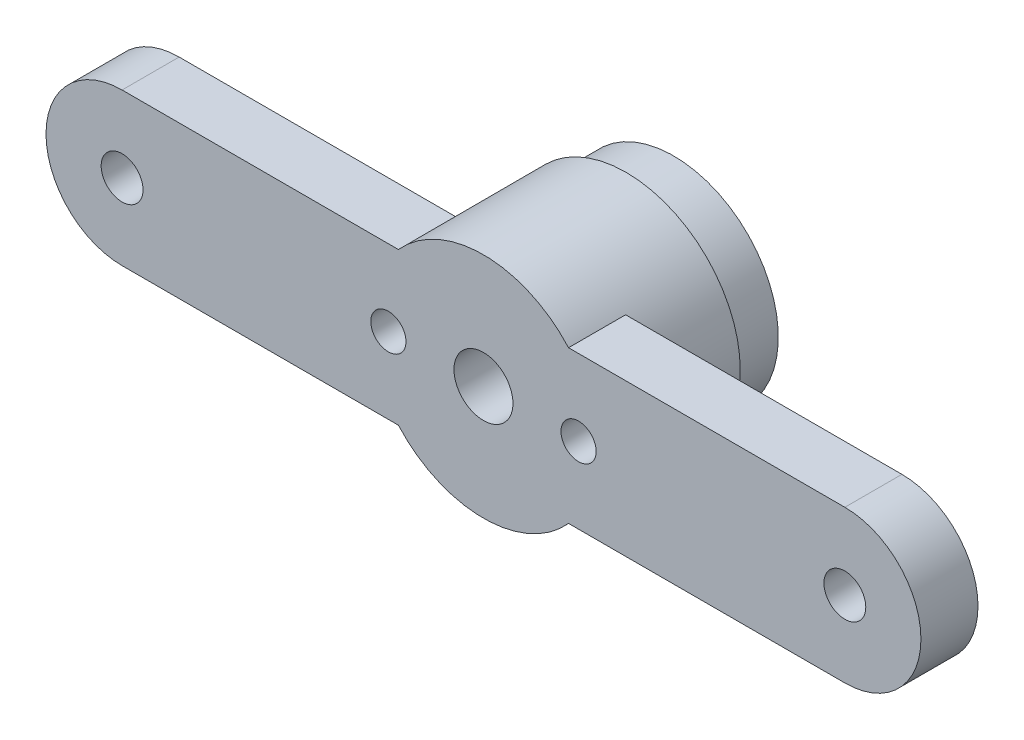
from build123d import *

# Parameters (mm, degrees)
SKETCH_1_R               = 1.55
SKETCH_1_R_2             = 1.1
EXTRUDE_1_DEPTH          = 3
EXTRUDE_START            = 4.5
SKETCH_2_R               = 6
EXTRUDE_2_DEPTH          = 4.5
SKETCH_3_R               = 5.5
EXTRUDE_3_DEPTH          = 2.5
SKETCH_5_R               = 0.4
CUT_EXTRUDE_1_DEPTH      = 5
PATTERN_CIRCULAR_2_COUNT = 25
SKETCH_4_R               = 2.6
CUT_EXTRUDE_2_DEPTH      = 5
CUT_EXTRUDE_START        = -30
SKETCH_6_R               = 1.55
CUT_EXTRUDE_3_DEPTH      = 30
SKETCH_7_R               = 0.925
CUT_EXTRUDE_4_DEPTH      = 6
SKETCH_8_W               = 1.6
SKETCH_8_H               = 4.2
CUT_EXTRUDE_5_DEPTH      = 3.2
SKETCH_9_W               = 1.6
SKETCH_9_H               = 4.2
CUT_EXTRUDE_6_DEPTH      = 3.2


with BuildPart() as part:
    # 草图1 → 凸台-拉伸1 (new body)
    with BuildSketch(Plane.XY):
        with BuildLine():
            Line((4.472135955, 4), (19, 4))
            ThreePointArc((19, 4), (23, 0), (19, -4))
            Line((19, -4), (4.472135955, -4))
            ThreePointArc((4.472135955, -4), (0, -6), (-4.472135955, -4))
            Line((-4.472135955, -4), (-19, -4))
            ThreePointArc((-19, -4), (-23, 0), (-19, 4))
            Line((-19, 4), (-4.472135955, 4))
            ThreePointArc((-4.472135955, 4), (0, 6), (4.472135955, 4))
        make_face()
        Circle(SKETCH_1_R, mode=Mode.SUBTRACT)
        with Locations((19, 0)):
            Circle(SKETCH_1_R_2, mode=Mode.SUBTRACT)
        with Locations((-19, 0)):
            Circle(SKETCH_1_R_2, mode=Mode.SUBTRACT)
    extrude(amount=EXTRUDE_1_DEPTH)

    # 草图2 → 凸台-拉伸2 (add)
    with BuildSketch(Plane(origin=(0, 0, 0), x_dir=(-1, 0, 0), z_dir=(0, 0, -1)).offset(EXTRUDE_START)):
        Circle(SKETCH_2_R)
    extrude(amount=-EXTRUDE_2_DEPTH)

    # 草图3 → 凸台-拉伸3 (add)
    with BuildSketch(Plane(origin=(0, 0, -4.5), x_dir=(-1, 0, 0), z_dir=(0, 0, -1))):
        Circle(SKETCH_3_R)
    extrude(amount=EXTRUDE_3_DEPTH)

    # 草图5 → 切除-拉伸1 (cut)
    with BuildSketch(Plane(origin=(0, 0, -7), x_dir=(-1, 0, 0), z_dir=(0, 0, -1))):
        with Locations((0, 2.6)):
            Circle(SKETCH_5_R)
    cut_extrude_1 = extrude(amount=-CUT_EXTRUDE_1_DEPTH, mode=Mode.SUBTRACT)

    # 阵列(圆周)2: 切除-拉伸1 ×25 about axis
    pattern_circular_2_axis = Axis((0, 0, 0), (0, 0, 1))
    for i in range(1, PATTERN_CIRCULAR_2_COUNT):
        add(cut_extrude_1.rotate(pattern_circular_2_axis, i * 360 / PATTERN_CIRCULAR_2_COUNT), mode=Mode.SUBTRACT)

    # 草图4 → 切除-拉伸2 (cut)
    with BuildSketch(Plane(origin=(0, 0, -7), x_dir=(-1, 0, 0), z_dir=(0, 0, -1))):
        Circle(SKETCH_4_R)
    extrude(amount=-CUT_EXTRUDE_2_DEPTH, mode=Mode.SUBTRACT)

    # 草图6 → 切除-拉伸3 (cut)
    with BuildSketch(Plane.XY.offset(3).offset(CUT_EXTRUDE_START)):
        with Locations(Location((0, 0, 0), (0, 0, 180))):
            Circle(SKETCH_6_R)
    extrude(amount=CUT_EXTRUDE_3_DEPTH, mode=Mode.SUBTRACT)

    # 草图7 → 切除-拉伸4 (cut)
    with BuildSketch(Plane.XY.offset(3)):
        with Locations((5, 0)):
            Circle(SKETCH_7_R)
        with Locations((-5, 0)):
            Circle(SKETCH_7_R)
    extrude(amount=-CUT_EXTRUDE_4_DEPTH, mode=Mode.SUBTRACT)

    # 草图8 → 切除-拉伸5 (cut)
    with BuildSketch(Plane(origin=(6, 0, 0), x_dir=(0, 0, -1), z_dir=(1, 0, 0))):
        with Locations((0.8, 0)):
            Rectangle(SKETCH_8_W, SKETCH_8_H)
    extrude(amount=-CUT_EXTRUDE_5_DEPTH, mode=Mode.SUBTRACT)

    # 草图9 → 切除-拉伸6 (cut)
    with BuildSketch(Plane.ZY.offset(6)):
        with Locations((-0.8, 0)):
            Rectangle(SKETCH_9_W, SKETCH_9_H)
    extrude(amount=-CUT_EXTRUDE_6_DEPTH, mode=Mode.SUBTRACT)


solid = part.part
